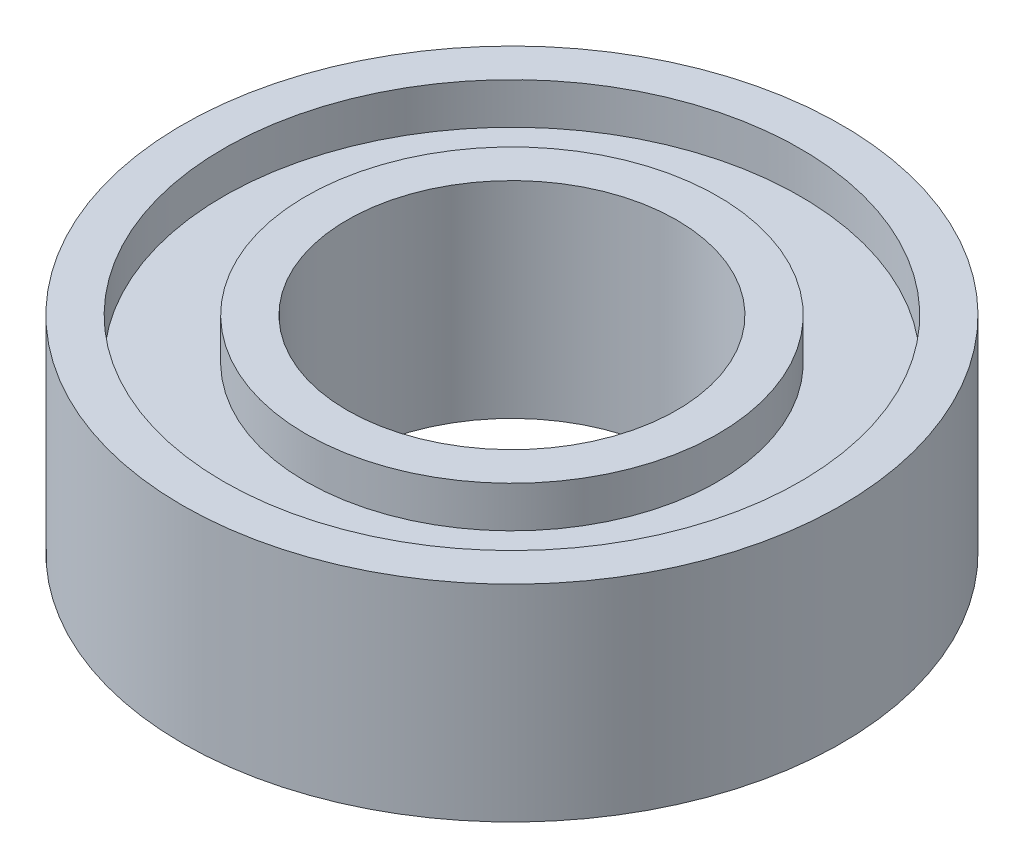
from build123d import *

# Parameters (mm, degrees)
SKETCH1_R           = 8
SKETCH1_R_2         = 4
BOSS_EXTRUDE1_DEPTH = 5
SKETCH2_R           = 7
SKETCH2_R_2         = 5
CUT_EXTRUDE1_DEPTH  = 1
CUT_EXTRUDE2_START  = -1
SKETCH3_R           = 7
SKETCH3_R_2         = 5
CUT_EXTRUDE2_DEPTH  = 1


with BuildPart() as part:
    # Sketch1 → Boss-Extrude1 (new body)
    with BuildSketch(Plane(origin=(0, 0, 0), x_dir=(1, 0, 0), z_dir=(0, 1, 0))):
        with Locations(Location((0, 0, 0), (0, 0, 270))):
            Circle(SKETCH1_R)
        with Locations(Location((0, 0, 0), (0, 0, 270))):
            Circle(SKETCH1_R_2, mode=Mode.SUBTRACT)
    extrude(amount=BOSS_EXTRUDE1_DEPTH)

    # Sketch2 → Cut-Extrude1 (cut)
    with BuildSketch(Plane(origin=(0, 5, 0), x_dir=(1, 0, 0), z_dir=(0, 1, 0))):
        with Locations(Location((0, 0, 0), (0, 0, 270))):
            Circle(SKETCH2_R)
        with Locations(Location((0, 0, 0), (0, 0, 270))):
            Circle(SKETCH2_R_2, mode=Mode.SUBTRACT)
    extrude(amount=-CUT_EXTRUDE1_DEPTH, mode=Mode.SUBTRACT)

    # Sketch3 → Cut-Extrude2 (cut)
    with BuildSketch(Plane.XZ.offset(CUT_EXTRUDE2_START)):
        with Locations(Location((0, 0, 0), (0, 0, 90))):
            Circle(SKETCH3_R)
        with Locations(Location((0, 0, 0), (0, 0, 90))):
            Circle(SKETCH3_R_2, mode=Mode.SUBTRACT)
    extrude(amount=CUT_EXTRUDE2_DEPTH, mode=Mode.SUBTRACT)


solid = part.part
